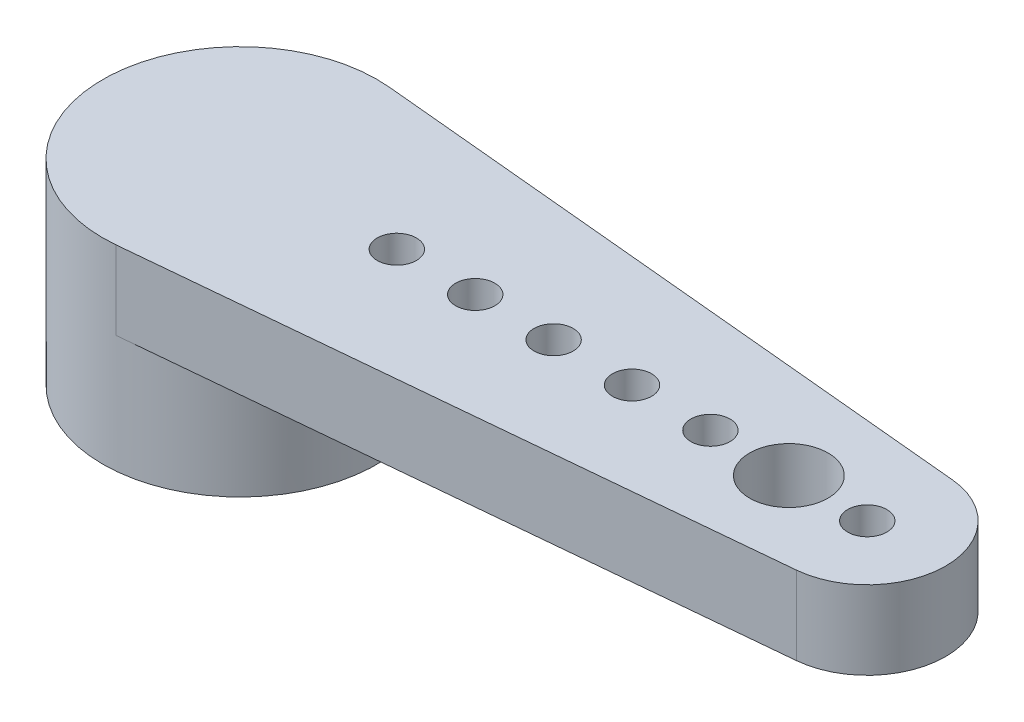
from build123d import *

# Parameters (mm, degrees)
SKETCH1_R           = 3.5
SKETCH1_R_2         = 2.4
BOSS_EXTRUDE1_DEPTH = 3
SKETCH2_R           = 1
SKETCH2_R_2         = 0.5
BOSS_EXTRUDE2_DEPTH = 2


with BuildPart() as part:
    # Sketch1 → Boss-Extrude1 (new body)
    with BuildSketch(Plane(origin=(0, 0, 0), x_dir=(1, 0, 0), z_dir=(0, 1, 0))):
        with Locations(Location((0, 0, 0), (0, 0, 270))):
            Circle(SKETCH1_R)
        with Locations(Location((0, 0, 0), (0, 0, 270))):
            Circle(SKETCH1_R_2, mode=Mode.SUBTRACT)
    extrude(amount=BOSS_EXTRUDE1_DEPTH)

    # Sketch2 → Boss-Extrude2 (add)
    with BuildSketch(Plane(origin=(0, 3, 0), x_dir=(1, 0, 0), z_dir=(0, 1, 0))):
        with BuildLine():
            Line((16.1875, 1.99119154), (0.328125, 3.484585195))
            ThreePointArc((0.328125, 3.484585195), (-3.5, 0), (0.328125, -3.484585195))
            Line((0.328125, -3.484585195), (16.1875, -1.99119154))
            ThreePointArc((16.1875, -1.99119154), (18, 0), (16.1875, 1.99119154))
        make_face()
        with Locations(Location((14, 0, 0), (0, 0, 270))):
            Circle(SKETCH2_R, mode=Mode.SUBTRACT)
        with Locations(Location((4, 0, 0), (0, 0, 180))):
            Circle(SKETCH2_R_2, mode=Mode.SUBTRACT)
        with Locations(Location((6, 0, 0), (0, 0, 270))):
            Circle(SKETCH2_R_2, mode=Mode.SUBTRACT)
        with Locations(Location((8, 0, 0), (0, 0, 270))):
            Circle(SKETCH2_R_2, mode=Mode.SUBTRACT)
        with Locations(Location((10, 0, 0), (0, 0, 270))):
            Circle(SKETCH2_R_2, mode=Mode.SUBTRACT)
        with Locations(Location((12, 0, 0), (0, 0, 270))):
            Circle(SKETCH2_R_2, mode=Mode.SUBTRACT)
        with Locations(Location((16, 0, 0), (0, 0, 270))):
            Circle(SKETCH2_R_2, mode=Mode.SUBTRACT)
    extrude(amount=BOSS_EXTRUDE2_DEPTH)


solid = part.part
